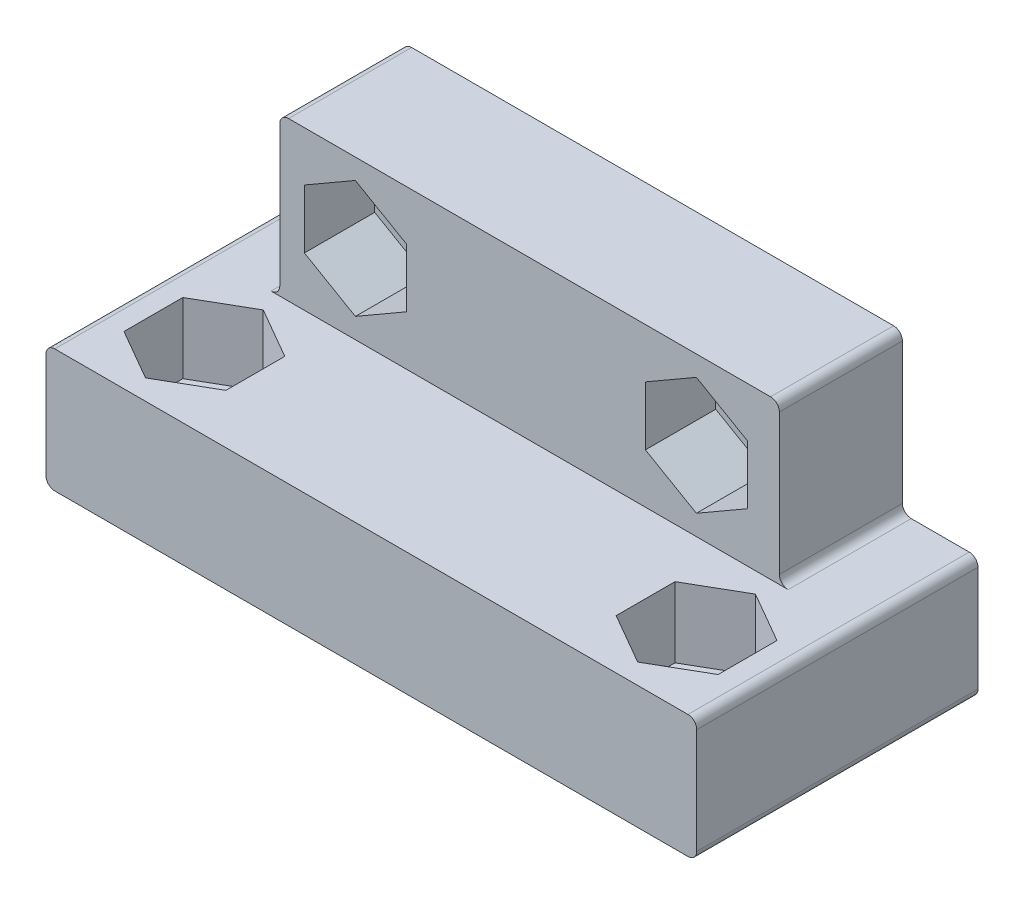
from build123d import *

# Parameters (mm, degrees)
SKETCH1_R           = 1.65
BOSS_EXTRUDE1_DEPTH = 16
CUT_EXTRUDE1_START  = -9
CUT_EXTRUDE1_DEPTH  = 9
CUT_EXTRUDE2_DEPTH  = 4
SKETCH4_R           = 1.65
CUT_EXTRUDE3_DEPTH  = 7
CUT_EXTRUDE4_DEPTH  = 4


with BuildPart() as part:
    # Sketch1 → Boss-Extrude1 (new body)
    with BuildSketch(Plane.XY):
        with BuildLine():
            Line((36.52, 7), (33.22, 7))
            ThreePointArc((33.22, 7), (32.866446609, 7.146446609), (32.72, 7.5))
            Line((32.72, 7.5), (32.72, 15.5))
            ThreePointArc((32.72, 15.5), (32.573553391, 15.853553391), (32.22, 16))
            Line((32.22, 16), (4.8, 16))
            ThreePointArc((4.8, 16), (4.446446609, 15.853553391), (4.3, 15.5))
            Line((4.3, 15.5), (4.3, 7.5))
            ThreePointArc((4.3, 7.5), (4.153553391, 7.146446609), (3.8, 7))
            Line((3.8, 7), (0.5, 7))
            ThreePointArc((0.5, 7), (0.146446609, 6.853553391), (0, 6.5))
            Line((0, 6.5), (0, 0.5))
            ThreePointArc((0, 0.5), (0.146446609, 0.146446609), (0.5, 0))
            Line((0.5, 0), (36.52, 0))
            ThreePointArc((36.52, 0), (36.873553391, 0.146446609), (37.02, 0.5))
            Line((37.02, 0.5), (37.02, 6.5))
            ThreePointArc((37.02, 6.5), (36.873553391, 6.853553391), (36.52, 7))
        make_face()
        with Locations((8.81, 11.5)):
            Circle(SKETCH1_R, mode=Mode.SUBTRACT)
        with Locations((28.21, 11.5)):
            Circle(SKETCH1_R, mode=Mode.SUBTRACT)
    extrude(amount=BOSS_EXTRUDE1_DEPTH)

    # Sketch2 → Cut-Extrude1 (cut)
    with BuildSketch(Plane.XY.offset(16).offset(CUT_EXTRUDE1_START)):
        with BuildLine():
            Line((33.22, 7), (3.8, 7))
            ThreePointArc((3.8, 7), (4.153553391, 7.146446609), (4.3, 7.5))
            Line((4.3, 7.5), (4.3, 16))
            Line((4.3, 16), (32.72, 16))
            Line((32.72, 16), (32.72, 7.5))
            ThreePointArc((32.72, 7.5), (32.866446609, 7.146446609), (33.22, 7))
        make_face()
    extrude(amount=CUT_EXTRUDE1_DEPTH, mode=Mode.SUBTRACT)

    # Sketch3 → Cut-Extrude2 (cut)
    with BuildSketch(Plane.XY.offset(7)):
        Polygon((8.6, 8.151368439), (11.5, 9.825684219), (11.5, 13.174315781), (8.6, 14.848631561), (5.7, 13.174315781), (5.7, 9.825684219), align=None)
        Polygon((28, 8.151368439), (30.9, 9.825684219), (30.9, 13.174315781), (28, 14.848631561), (25.1, 13.174315781), (25.1, 9.825684219), align=None)
    extrude(amount=-CUT_EXTRUDE2_DEPTH, mode=Mode.SUBTRACT)

    # Sketch4 → Cut-Extrude3 (cut)
    with BuildSketch(Plane(origin=(0, 7, 0), x_dir=(1, 0, 0), z_dir=(0, 1, 0))):
        with Locations(Location((32.51, -11.5, 0), (0, 0, 270))):
            Circle(SKETCH4_R)
        with Locations(Location((4.51, -11.5, 0), (0, 0, 270))):
            Circle(SKETCH4_R)
    extrude(amount=-CUT_EXTRUDE3_DEPTH, mode=Mode.SUBTRACT)

    # Sketch5 → Cut-Extrude4 (cut)
    with BuildSketch(Plane(origin=(0, 7, 0), x_dir=(1, 0, 0), z_dir=(0, 1, 0))):
        Polygon((32.51, -14.848631561), (35.41, -13.174315781), (35.41, -9.825684219), (32.51, -8.151368439), (29.61, -9.825684219), (29.61, -13.174315781), align=None)
        Polygon((4.51, -14.848631561), (7.41, -13.174315781), (7.41, -9.825684219), (4.51, -8.151368439), (1.61, -9.825684219), (1.61, -13.174315781), align=None)
    extrude(amount=-CUT_EXTRUDE4_DEPTH, mode=Mode.SUBTRACT)


solid = part.part
